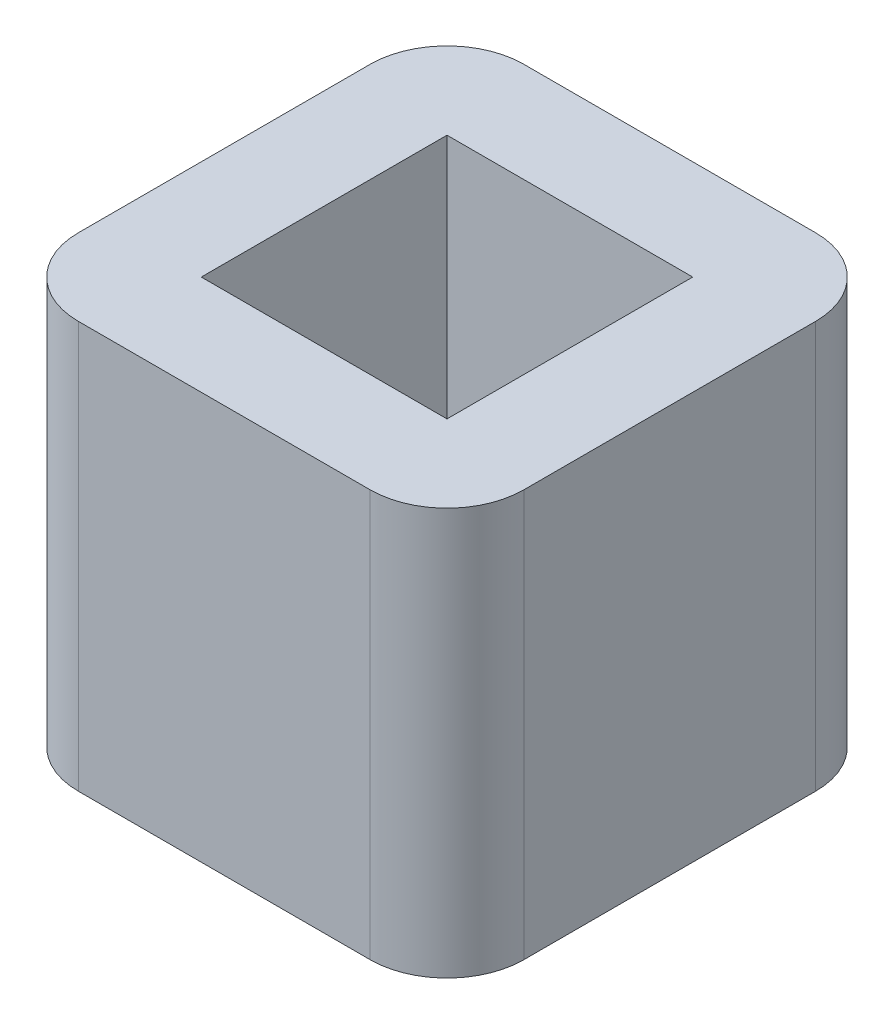
from build123d import *

# Parameters (mm, degrees)
SKETCH2_W           = 32
SKETCH2_H           = 32
BOSS_EXTRUDE1_DEPTH = 26.5


with BuildPart() as part:
    # Sketch2 → Boss-Extrude1 (new, symmetric)
    with BuildSketch(Plane(origin=(0, 0, 0), x_dir=(1, 0, 0), z_dir=(0, 1, 0))):
        with BuildLine():
            Line((-29, 19), (-29, -19))
            ThreePointArc((-29, -19), (-26.071067812, -26.071067812), (-19, -29))
            Line((-19, -29), (19, -29))
            ThreePointArc((19, -29), (26.071067812, -26.071067812), (29, -19))
            Line((29, -19), (29, 19))
            ThreePointArc((29, 19), (26.071067812, 26.071067812), (19, 29))
            Line((19, 29), (-19, 29))
            ThreePointArc((-19, 29), (-26.071067812, 26.071067812), (-29, 19))
        make_face()
        Rectangle(SKETCH2_W, SKETCH2_H, mode=Mode.SUBTRACT)
    extrude(amount=BOSS_EXTRUDE1_DEPTH, both=True)


solid = part.part
